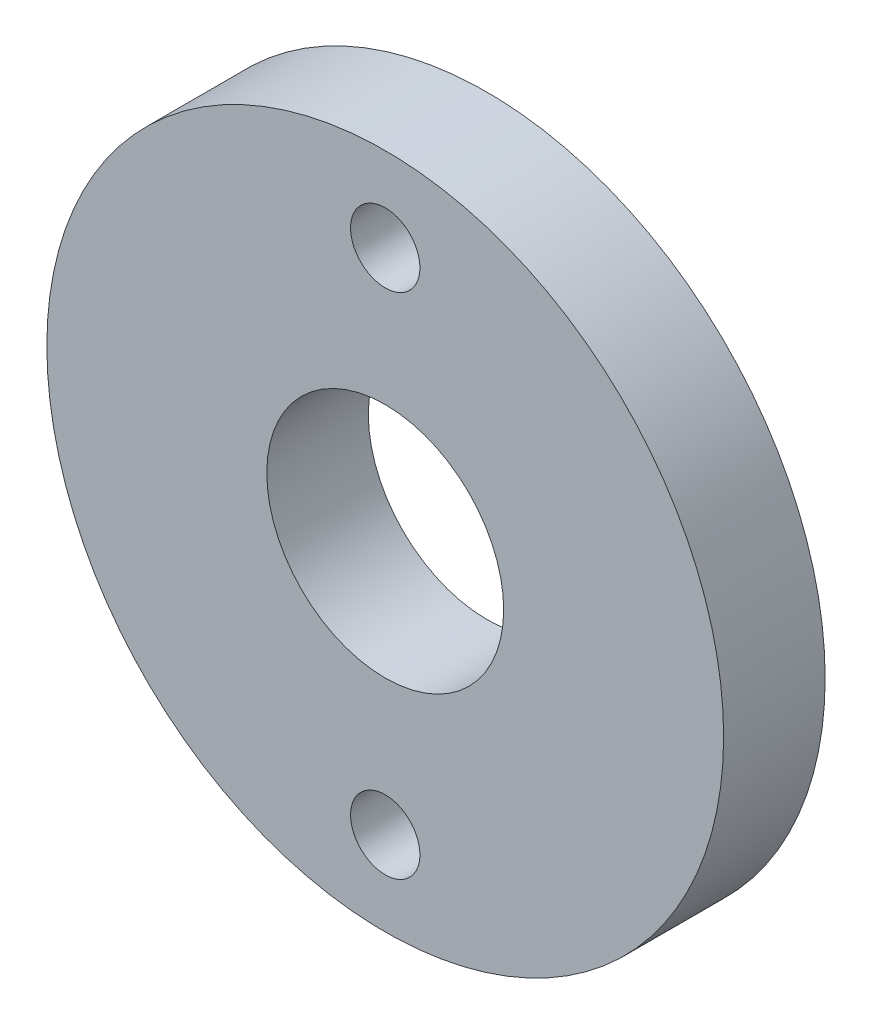
from build123d import *

# Parameters (mm, degrees)
CROQUIS1_R              = 10
SALIENTE_EXTRUIR1_DEPTH = 3
CROQUIS2_R              = 1.025
CROQUIS2_R_2            = 3.5
CORTAR_EXTRUIR1_DEPTH   = 3


with BuildPart() as part:
    # Croquis1 → Saliente-Extruir1 (new body)
    with BuildSketch(Plane.XY):
        Circle(CROQUIS1_R)
    extrude(amount=SALIENTE_EXTRUIR1_DEPTH)

    # Croquis2 → Cortar-Extruir1 (cut)
    with BuildSketch(Plane.XY.offset(3)):
        with Locations((0, 7.51)):
            Circle(CROQUIS2_R)
        with Locations((0, -7.51)):
            Circle(CROQUIS2_R)
        Circle(CROQUIS2_R_2)
    extrude(amount=-CORTAR_EXTRUIR1_DEPTH, mode=Mode.SUBTRACT)


solid = part.part
